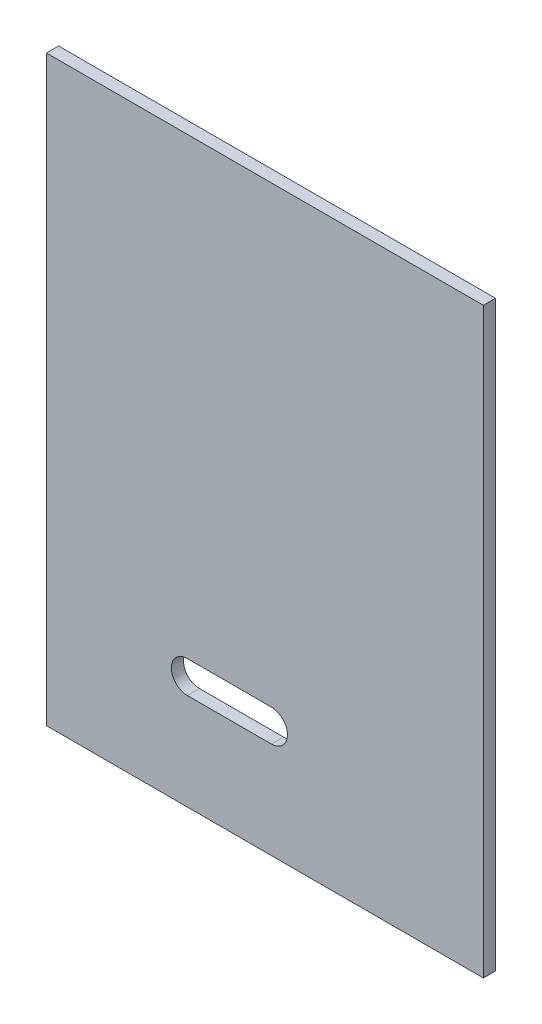
from build123d import *

# Parameters (mm, degrees)
SKETCH1_W           = 228.6
SKETCH1_H           = 304.8
BOSS_EXTRUDE1_DEPTH = 6.35
CUT_EXTRUDE1_DEPTH  = 382.052912992


with BuildPart() as part:
    # Sketch1 → Boss-Extrude1 (new body)
    with BuildSketch(Plane.XY):
        with Locations((114.3, 152.4)):
            Rectangle(SKETCH1_W, SKETCH1_H)
    extrude(amount=BOSS_EXTRUDE1_DEPTH)

    # Sketch2 → Cut-Extrude1 (cut, through all)
    with BuildSketch(Plane.XY.offset(6.35)):
        with BuildLine():
            Line((73.704948761, 67.277501562), (117.706772469, 67.277501562))
            ThreePointArc((117.706772469, 67.277501562), (126.075907581, 58.90836645), (117.706772469, 50.539231337))
            Line((117.706772469, 50.539231337), (73.704948761, 50.539231337))
            ThreePointArc((73.704948761, 50.539231337), (65.335813649, 58.90836645), (73.704948761, 67.277501562))
        make_face()
    extrude(amount=-CUT_EXTRUDE1_DEPTH, mode=Mode.SUBTRACT)


solid = part.part
